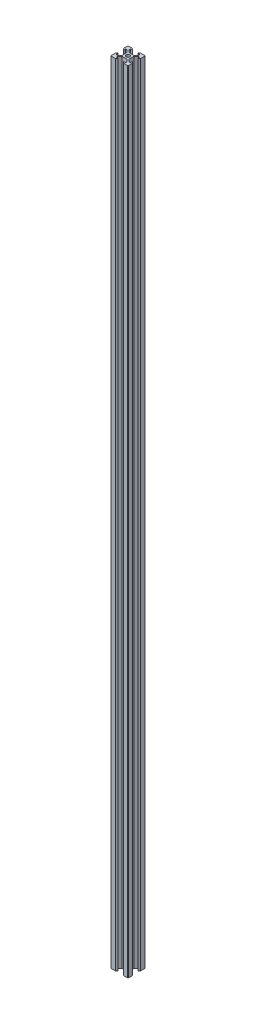
from build123d import *

# Parameters (mm, degrees)
SKETCH2_R              = 2.074585303
VSLOT2020_2020_5_DEPTH = 914.4


with BuildPart() as part:
    # Sketch2 → Vslot2020 2020(5) (new body)
    with BuildSketch(Plane.ZX):
        with BuildLine():
            Line((13.9, 7.149086807), (13.9, 12.844511469))
            Line((13.9, 12.844511469), (16.558493656, 15.492177728))
            Line((16.558493656, 15.492177728), (16.550703242, 15.5))
            Line((16.550703242, 15.5), (18.2, 15.5))
            Line((18.2, 15.5), (18.2, 13.12))
            Line((18.2, 13.12), (18.534428266, 13.12))
            Line((18.534428266, 13.12), (20, 14.58))
            Line((20, 14.58), (20, 19.5))
            ThreePointArc((20, 19.5), (19.853553391, 19.853553391), (19.5, 20))
            Line((19.5, 20), (14.575, 20))
            Line((14.575, 20), (13.12, 18.545))
            Line((13.12, 18.545), (13.12, 18.2))
            Line((13.12, 18.2), (15.5, 18.2))
            Line((15.5, 18.2), (15.5, 16.555))
            Line((15.5, 16.555), (12.834142613, 13.9))
            Line((12.834142613, 13.9), (7.155, 13.9))
            Line((7.155, 13.9), (4.5, 16.555))
            Line((4.5, 16.555), (4.5, 18.2))
            Line((4.5, 18.2), (6.875, 18.2))
            Line((6.875, 18.2), (6.875, 18.545))
            Line((6.875, 18.545), (5.42, 20))
            Line((5.42, 20), (0.5, 20))
            ThreePointArc((0.5, 20), (0.146446609, 19.853553391), (0, 19.5))
            Line((0, 19.5), (0, 14.58))
            Line((0, 14.58), (1.46, 13.12))
            Line((1.46, 13.12), (1.8, 13.12))
            Line((1.8, 13.12), (1.8, 15.5))
            Line((1.8, 15.5), (3.445, 15.5))
            Line((3.445, 15.5), (3.439339828, 15.494339828))
            Line((3.439339828, 15.494339828), (6.094339828, 12.839339828))
            Line((6.094339828, 12.839339828), (6.1, 12.845))
            Line((6.1, 12.845), (6.1, 7.149086807))
            Line((6.1, 7.149086807), (3.439339828, 4.5))
            Line((3.439339828, 4.5), (1.8, 4.5))
            Line((1.8, 4.5), (1.8, 6.88))
            Line((1.8, 6.88), (1.46, 6.88))
            Line((1.46, 6.88), (0, 5.42))
            Line((0, 5.42), (0, 0.5))
            ThreePointArc((0, 0.5), (0.146446609, 0.146446609), (0.5, 0))
            Line((0.5, 0), (5.42, 0))
            Line((5.42, 0), (6.875, 1.455))
            Line((6.875, 1.455), (6.875, 1.8))
            Line((6.875, 1.8), (4.5, 1.8))
            Line((4.5, 1.8), (4.5, 3.4393348))
            Line((4.5, 3.4393348), (7.158345795, 6.086117297))
            Line((7.158345795, 6.086117297), (7.144523479, 6.1))
            Line((7.144523479, 6.1), (12.854625295, 6.1))
            Line((12.854625295, 6.1), (12.841221344, 6.086548451))
            Line((12.841221344, 6.086548451), (15.499715, 3.437461644))
            Line((15.499715, 3.437461644), (15.5, 1.8))
            Line((15.5, 1.8), (13.12, 1.8))
            Line((13.12, 1.8), (13.12, 1.455))
            Line((13.12, 1.455), (14.575, 0))
            Line((14.575, 0), (19.5, 0))
            ThreePointArc((19.5, 0), (19.853553391, 0.146446609), (20, 0.5))
            Line((20, 0.5), (20, 5.42))
            Line((20, 5.42), (18.606904708, 6.88))
            Line((18.606904708, 6.88), (18.2, 6.88))
            Line((18.2, 6.88), (18.2, 4.5))
            Line((18.2, 4.5), (16.558493656, 4.5))
            Line((16.558493656, 4.5), (13.9, 7.149086807))
        make_face()
        with Locations((10, 10)):
            Circle(SKETCH2_R, mode=Mode.SUBTRACT)
    extrude(amount=VSLOT2020_2020_5_DEPTH)


solid = part.part
